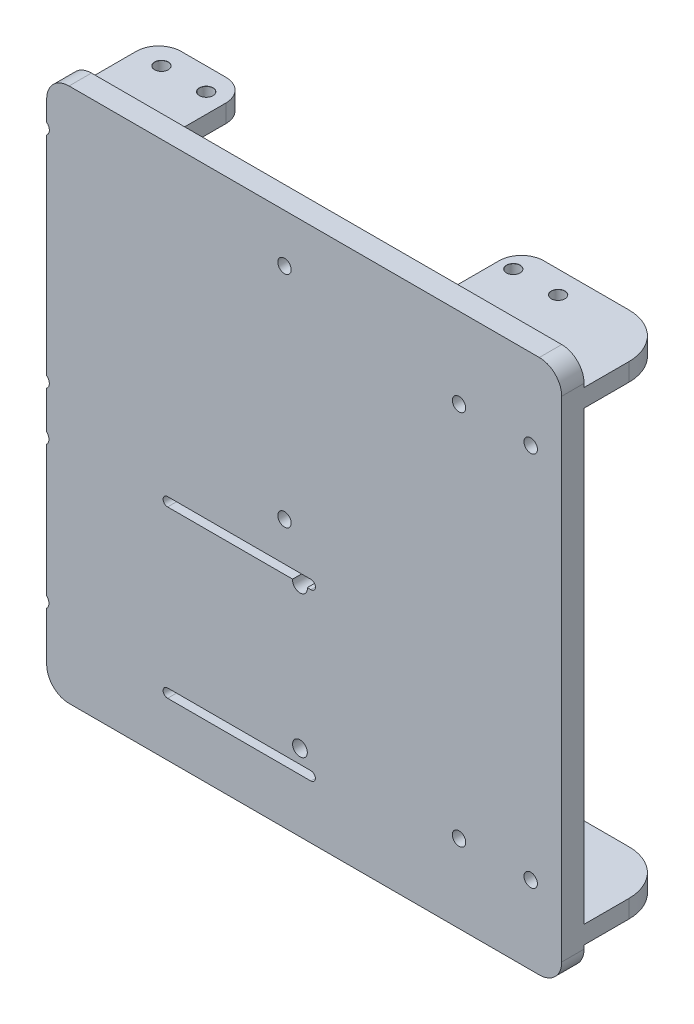
from build123d import *

# Parameters (mm, degrees)
SKETCH_1_W            = 115
SKETCH_1_H            = 119.4
EXTRUDE_1_DEPTH       = 5
SKETCH_2_W            = 20
SKETCH_2_H            = 4
SKETCH_2_W_2          = 34
EXTRUDE_2_DEPTH       = 20
F_3_0MM_1_D           = 3
F_3_0MM_1_CSINK_D     = 3.05
F_3_0MM_1_CSINK_ANGLE = 90
FILLET_1_R            = 10
FILLET_2_R            = 5
FILLET_3_R            = 5
SKETCH_5_R            = 1.5
SKETCH_5_R_2          = 1.499237998
SKETCH_5_R_3          = 1.65
CUT_EXTRUDE_1_DEPTH   = 106.373307238
CUT_EXTRUDE_2_DEPTH   = 106.373307262


with BuildPart() as part:
    # 草图1 → 凸台-拉伸1 (new body)
    with BuildSketch(Plane.XY):
        with Locations((25.302465961, 0.485426053)):
            Rectangle(SKETCH_1_W, SKETCH_1_H)
    extrude(amount=EXTRUDE_1_DEPTH)

    # 草图2 → 凸台-拉伸2 (add)
    with BuildSketch(Plane(origin=(0, 0, 0), x_dir=(-1, 0, 0), z_dir=(0, 0, -1))):
        with Locations((22.197534039, 52.385426053)):
            Rectangle(SKETCH_2_W, SKETCH_2_H)
        with Locations((-65.802465961, 52.385426053)):
            Rectangle(SKETCH_2_W_2, SKETCH_2_H)
        with Locations((-65.802465961, -51.414573947)):
            Rectangle(SKETCH_2_W_2, SKETCH_2_H)
        with Locations((22.197534039, -51.414573947)):
            Rectangle(SKETCH_2_W, SKETCH_2_H)
    extrude(amount=EXTRUDE_2_DEPTH)

    # Ø3.0mm 暗销孔1 (through all)
    with Locations(Plane(origin=(0, 54.385426053, 0), x_dir=(1, 0, 0), z_dir=(0, 1, 0))):
        with Locations((62, 15), (-16.57, 15), (-26.57, 15), (52, 15)):
            CounterSinkHole(F_3_0MM_1_D / 2, F_3_0MM_1_CSINK_D / 2, counter_sink_angle=F_3_0MM_1_CSINK_ANGLE)

    # 圆角1
    fillet_1_edges = [part.edges().sort_by_distance(p)[0] for p in [
        (82.802465961, 52.385426053, -20),
        (82.802465961, -51.414573947, -20),
    ]]
    fillet(fillet_1_edges, radius=FILLET_1_R)

    # 圆角2
    fillet_2_edges = [part.edges().sort_by_distance(p)[0] for p in [
        (-12.197534039, 52.385426053, -20),
        (-32.197534039, 52.385426053, -20),
        (48.802465961, 52.385426053, -20),
        (48.802465961, -51.414573947, -20),
        (-12.197534039, -51.414573947, -20),
        (-32.197534039, -51.414573947, -20),
    ]]
    fillet(fillet_2_edges, radius=FILLET_2_R)

    # 圆角3
    fillet_3_edges = [part.edges().sort_by_distance(p)[0] for p in [
        (-32.197534039, 60.185426053, 2.5),
        (82.802465961, 60.185426053, 2.5),
        (82.802465961, -59.214573947, 2.5),
        (-32.197534039, -59.214573947, 2.5),
    ]]
    fillet(fillet_3_edges, radius=FILLET_3_R)

    # 草图5 → 切除-拉伸1 (cut, through all)
    with BuildSketch(Plane.XY.offset(5)):
        with Locations((-33.10026153, 49.4399256)):
            Circle(SKETCH_5_R)
        with Locations((20.89973847, 49.439163598)):
            Circle(SKETCH_5_R_2)
        with Locations((20.89973847, 0.4399256)):
            Circle(SKETCH_5_R)
        with Locations((-33.10026153, 0.4399256)):
            Circle(SKETCH_5_R)
        with Locations((59.875063234, 42.198126078)):
            Circle(SKETCH_5_R)
        with Locations((75.875063234, 42.198126078)):
            Circle(SKETCH_5_R)
        with Locations((59.875063234, -41.801873922)):
            Circle(SKETCH_5_R)
        with Locations((75.875063234, -41.801873922)):
            Circle(SKETCH_5_R)
        with Locations((-33.346706732, -42.112908038)):
            Circle(SKETCH_5_R_3)
        with Locations((-33.346706732, -10.412908038)):
            Circle(SKETCH_5_R_3)
        with Locations((24.353293268, -10.412908038)):
            Circle(SKETCH_5_R_3)
        with Locations((24.353293268, -42.112908038)):
            Circle(SKETCH_5_R_3)
    extrude(amount=-CUT_EXTRUDE_1_DEPTH, mode=Mode.SUBTRACT)

    # 草图6 → 切除-拉伸2 (cut, through all)
    with BuildSketch(Plane.XY.offset(5)):
        with BuildLine():
            Line((-5.197534039, -8.214573947), (26.802465961, -8.214573947))
            ThreePointArc((26.802465961, -8.214573947), (27.802465961, -9.214573947), (26.802465961, -10.214573947))
            Line((26.802465961, -10.214573947), (-5.197534039, -10.214573947))
            ThreePointArc((-5.197534039, -10.214573947), (-6.197534039, -9.214573947), (-5.197534039, -8.214573947))
        make_face()
        with BuildLine():
            Line((-5.197534039, -45.214573947), (26.802465961, -45.214573947))
            ThreePointArc((26.802465961, -45.214573947), (27.802465961, -46.214573947), (26.802465961, -47.214573947))
            Line((26.802465961, -47.214573947), (-5.197534039, -47.214573947))
            ThreePointArc((-5.197534039, -47.214573947), (-6.197534039, -46.214573947), (-5.197534039, -45.214573947))
        make_face()
    extrude(amount=-CUT_EXTRUDE_2_DEPTH, mode=Mode.SUBTRACT)


solid = part.part
